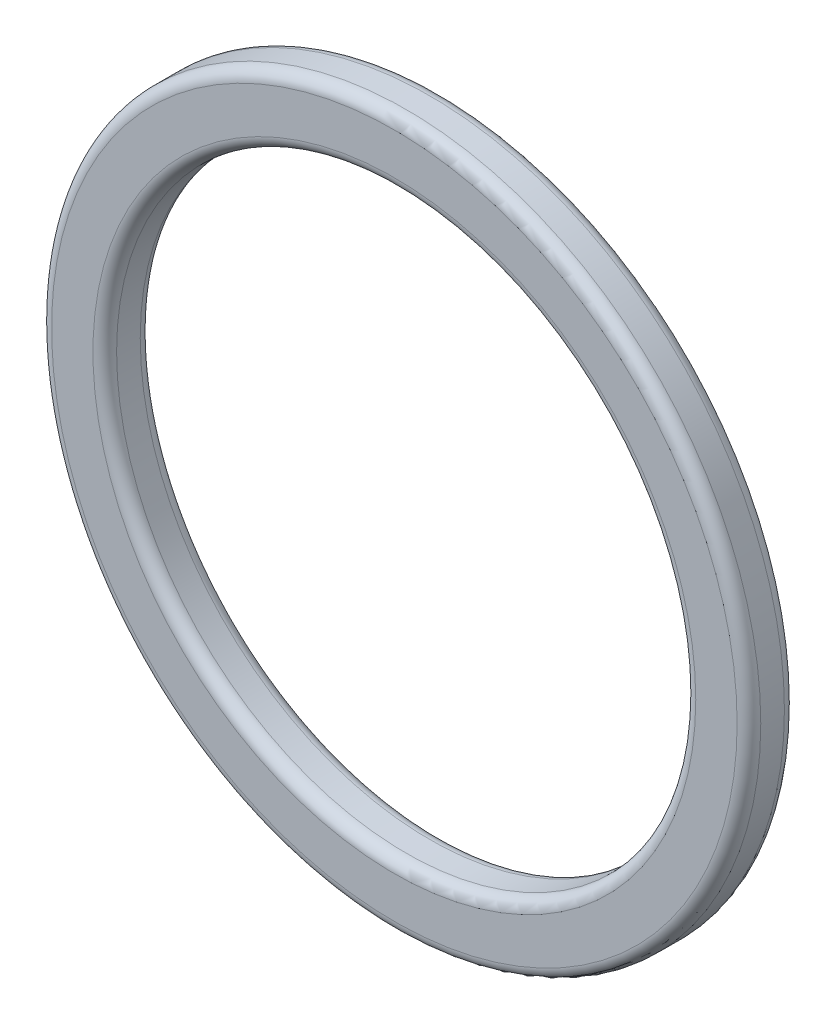
from build123d import *

# Parameters (mm, degrees)
SKETCH1_R           = 15
SKETCH1_R_2         = 12.25
BOSS_EXTRUDE1_DEPTH = 2
FILLET1_R           = 0.5
FILLET2_R           = 0.5
FILLET3_R           = 0.5


with BuildPart() as part:
    # Sketch1 → Boss-Extrude1 (new body)
    with BuildSketch(Plane.XY):
        Circle(SKETCH1_R)
        Circle(SKETCH1_R_2, mode=Mode.SUBTRACT)
    extrude(amount=BOSS_EXTRUDE1_DEPTH)

    # Fillet1
    fillet1_edges = [part.edges().sort_by_distance(p)[0] for p in [
        (-15, 0, 2),
        (-12.25, 0, 2),
    ]]
    fillet(fillet1_edges, radius=FILLET1_R)

    # Fillet2
    fillet2_edges = [part.edges().sort_by_distance(p)[0] for p in [
        (-15, 0, 0),
    ]]
    fillet(fillet2_edges, radius=FILLET2_R)

    # Fillet3
    fillet3_edges = [part.edges().sort_by_distance(p)[0] for p in [
        (-12.25, 0, 0),
    ]]
    fillet(fillet3_edges, radius=FILLET3_R)


solid = part.part
